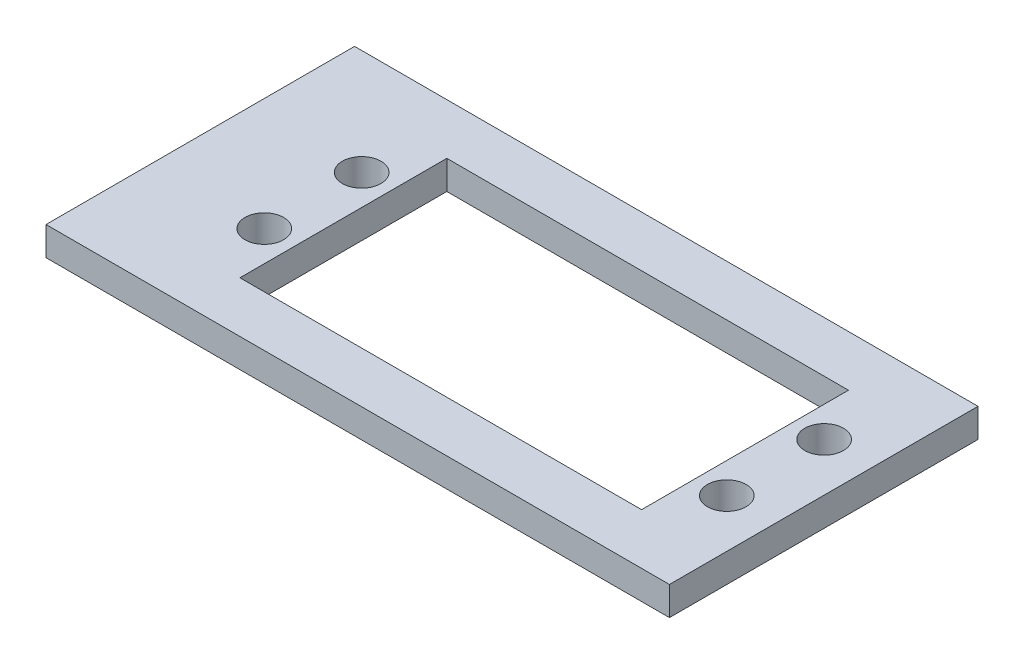
from build123d import *

# Parameters (mm, degrees)
SKETCH1_R           = 2.0193
SKETCH1_W           = 41.91
SKETCH1_H           = 5.304051748
BOSS_EXTRUDE1_DEPTH = 3


with BuildPart() as part:
    # Sketch1 → Boss-Extrude1 (new body)
    # profile 1 of 2: a face of its own
    with BuildSketch(Plane(origin=(0, 0, 0), x_dir=(1, 0, 0), z_dir=(0, 1, 0))):
        Polygon((0.189585243, 26.171402615), (0.189585243, 20.867350867), (0.189585243, -0.722649133), (-41.720414757, -0.722649133), (-41.720414757, 8.08226518), (-41.720414757, 12.010049159), (-41.720414757, 20.867350867), (-41.720414757, 26.171402615), (-56.653469857, 26.171402615), (-56.653469857, -6.026700881), (8.402064139, -6.026700881), (8.402064139, 26.171402615), align=None)
        with Locations(Location((-44.895414757, 4.992350867, 0), (0, 0, 270))):
            Circle(SKETCH1_R, mode=Mode.SUBTRACT)
        with Locations(Location((3.364585243, 4.992350867, 0), (0, 0, 270))):
            Circle(SKETCH1_R, mode=Mode.SUBTRACT)
        with Locations(Location((-44.895414757, 15.152350867, 0), (0, 0, 270))):
            Circle(SKETCH1_R, mode=Mode.SUBTRACT)
        with Locations(Location((3.364585243, 15.152350867, 0), (0, 0, 270))):
            Circle(SKETCH1_R, mode=Mode.SUBTRACT)
    # profile 2 of 2: a face of its own
    with BuildSketch(Plane(origin=(0, 0, 0), x_dir=(1, 0, 0), z_dir=(0, 1, 0))):
        with Locations((-20.765414757, 23.519376741)):
            Rectangle(SKETCH1_W, SKETCH1_H)
    extrude(amount=BOSS_EXTRUDE1_DEPTH)


solid = part.part
